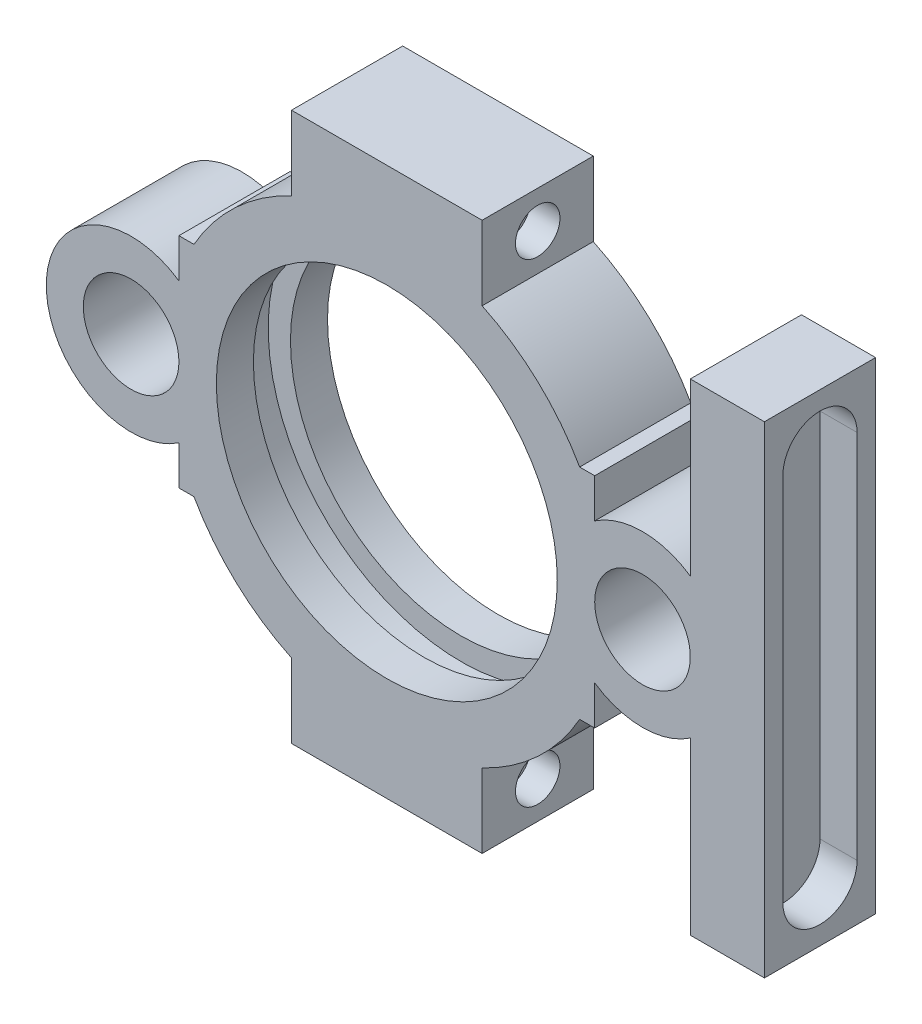
from build123d import *
from build123d.topology import SkipClean

# Parameters (mm, degrees)
SKETCH1_R           = 6.45
BOSS_EXTRUDE1_DEPTH = 15
SKETCH2_W           = 5
SKETCH2_H           = 3
CUT_EXTRUDE3_DEPTH  = 5
CUT_EXTRUDE4_START  = -40
SKETCH4_R           = 1.5
CUT_EXTRUDE4_DEPTH  = 63
SKETCH5_R           = 3
CUT_EXTRUDE5_DEPTH  = 4
CUT_EXTRUDE6_START  = -80
CUT_EXTRUDE6_DEPTH  = 80


with BuildPart() as part:
    # Sketch1 → Boss-Extrude1 (new body)
    with BuildSketch(Plane.XY):
        with BuildLine():
            Line((0, 23), (0, 37))
            Line((0, 37), (12.859510911, 37))
            Line((12.859510911, 37), (12.859510911, 27))
            ThreePointArc((12.859510911, 27), (20.383390121, 21.88342816), (26.020458433, 14.741192754))
            Line((26.020458433, 14.741192754), (28.050458433, 14.741192754))
            Line((28.050458433, 14.741192754), (28.050458433, 9.460443964))
            ThreePointArc((28.050458433, 9.460443964), (34.500458433, 11.45), (40.950458433, 9.460443964))
            Line((40.950458433, 9.460443964), (40.950458433, 32.5))
            Line((40.950458433, 32.5), (50.950458433, 32.5))
            Line((50.950458433, 32.5), (50.950458433, -32.5))
            Line((50.950458433, -32.5), (40.950458433, -32.5))
            Line((40.950458433, -32.5), (40.950458433, -9.460443964))
            ThreePointArc((40.950458433, -9.460443964), (34.500458433, -11.45), (28.050458433, -9.460443964))
            Line((28.050458433, -9.460443964), (28.050458433, -14.741192754))
            Line((28.050458433, -14.741192754), (26.020458433, -14.741192754))
            ThreePointArc((26.020458433, -14.741192754), (20.383390121, -21.88342816), (12.859510911, -27))
            Line((12.859510911, -27), (12.859510911, -37))
            Line((12.859510911, -37), (0, -37))
            Line((0, -37), (0, -23))
            ThreePointArc((0, -23), (23, 0), (0, 23))
        make_face()
        with Locations(Location((34.500458433, 0, 0), (0, 0, 180))):
            Circle(SKETCH1_R, mode=Mode.SUBTRACT)
    boss_extrude1 = extrude(amount=BOSS_EXTRUDE1_DEPTH)

    # Sketch2 → Cut-Revolve1 (revolve, cut)
    with BuildSketch(Plane.ZY):
        with Locations((7.5, 24.5)):
            Rectangle(SKETCH2_W, SKETCH2_H)
    cut_revolve1 = revolve(axis=Axis((0, 0, 15), (0, 0, -1)), mode=Mode.SUBTRACT)

    # Sketch3 → Cut-Extrude3 (cut)
    with BuildSketch(Plane(origin=(50.950458433, 0, 0), x_dir=(0, 0, -1), z_dir=(1, 0, 0))):
        with BuildLine():
            Line((-12.5, -25), (-12.5, 25))
            ThreePointArc((-12.5, 25), (-7.5, 30), (-2.5, 25))
            Line((-2.5, 25), (-2.5, -25))
            ThreePointArc((-2.5, -25), (-7.5, -30), (-12.5, -25))
        make_face()
    extrude(amount=-CUT_EXTRUDE3_DEPTH, mode=Mode.SUBTRACT)

    # Sketch4 → Cut-Extrude4 (cut)
    with BuildSketch(Plane(origin=(12.859510911, 0, 0), x_dir=(0, 0, -1), z_dir=(1, 0, 0)).offset(CUT_EXTRUDE4_START)):
        with Locations((-7.333431897, 32)):
            Circle(SKETCH4_R)
        with Locations((-7.333431897, -32)):
            Circle(SKETCH4_R)
    cut_extrude4 = extrude(amount=CUT_EXTRUDE4_DEPTH, mode=Mode.SUBTRACT)

    # Sketch5 → Cut-Extrude5 (cut)
    with BuildSketch(Plane(origin=(12.859510911, 0, 0), x_dir=(0, 0, -1), z_dir=(1, 0, 0))):
        with Locations((-7.5, 32)):
            Circle(SKETCH5_R)
        with Locations(Location((-7.5, -32, 0), (0, 0, 180))):
            Circle(SKETCH5_R)
    cut_extrude5 = extrude(amount=-CUT_EXTRUDE5_DEPTH, mode=Mode.SUBTRACT)

    # Mirror1: Boss-Extrude1, Cut-Revolve1, Cut-Extrude4, Cut-Extrude5 across plane
    add(boss_extrude1.mirror(Plane.ZY))
    add(cut_revolve1.mirror(Plane.ZY), mode=Mode.SUBTRACT)
    add(cut_extrude4.mirror(Plane.ZY), mode=Mode.SUBTRACT)
    add(cut_extrude5.mirror(Plane.ZY), mode=Mode.SUBTRACT)

    # Sketch6 → Cut-Extrude6 (cut)
    with SkipClean():  # the faces are left unmerged after this step: merging them gives an invalid solid
        with BuildSketch(Plane.XY.offset(15).offset(CUT_EXTRUDE6_START)):
            with BuildLine():
                Line((-40.950458433, 9.460443964), (-40.950458433, 38.741811421))
                Line((-40.950458433, 38.741811421), (-62.772471418, 38.741811421))
                Line((-62.772471418, 38.741811421), (-62.772471418, -39.471412389))
                Line((-62.772471418, -39.471412389), (-40.950458433, -39.471412389))
                Line((-40.950458433, -39.471412389), (-40.950458433, -9.460443964))
                ThreePointArc((-40.950458433, -9.460443964), (-45.950458433, 0), (-40.950458433, 9.460443964))
            make_face()
        extrude(amount=CUT_EXTRUDE6_DEPTH, mode=Mode.SUBTRACT)


solid = part.part
